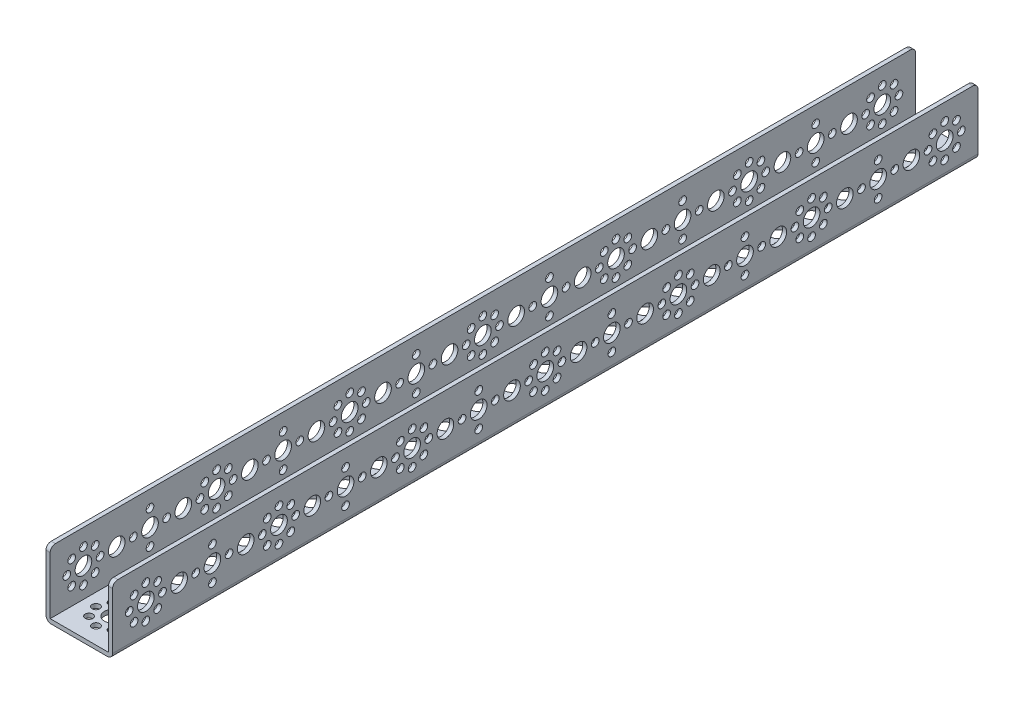
from build123d import *

# Parameters (mm, degrees)
SKETCH1_W                      = 32
SKETCH1_H                      = 416
BOSS_EXTRUDE1_DEPTH            = 32
SKETCH2_W                      = 28
SKETCH2_H                      = 30
CUT_EXTRUDE1_DEPTH             = 418.535627222
F_8_0_8_DIAMETER_HOLE1_D       = 8
F_8_0_8_DIAMETER_HOLE1_DEPTH   = 2
F_8_0_8_DIAMETER_HOLE2_D       = 8
F_8_0_8_DIAMETER_HOLE2_DEPTH   = 2
F_3_7_3_7_DIAMETER_HOLE1_D     = 3.7
F_3_7_3_7_DIAMETER_HOLE1_DEPTH = 2
F_3_7_3_7_DIAMETER_HOLE2_D     = 3.7
F_3_7_3_7_DIAMETER_HOLE2_DEPTH = 32
F_8_0_8_DIAMETER_HOLE3_D       = 8
F_8_0_8_DIAMETER_HOLE3_DEPTH   = 32
F_8_0_8_DIAMETER_HOLE4_D       = 8
F_8_0_8_DIAMETER_HOLE4_DEPTH   = 32
F_3_7_3_7_DIAMETER_HOLE3_D     = 3.7
F_3_7_3_7_DIAMETER_HOLE3_DEPTH = 32
FILLET1_R                      = 2.5


with BuildPart() as part:
    # Sketch1 → Boss-Extrude1 (new body)
    with BuildSketch(Plane(origin=(-16, 0, 0), x_dir=(0, -1, 0), z_dir=(-1, 0, 0))):
        with Locations((-16, -192)):
            Rectangle(SKETCH1_W, SKETCH1_H)
    extrude(amount=-BOSS_EXTRUDE1_DEPTH)

    # Sketch2 → Cut-Extrude1 (cut, through all)
    with BuildSketch(Plane.XY.offset(16)):
        with Locations((0, 17)):
            Rectangle(SKETCH2_W, SKETCH2_H)
    extrude(amount=-CUT_EXTRUDE1_DEPTH, mode=Mode.SUBTRACT)

    # Ø8.0 (8) Diameter Hole1
    with Locations(Plane.ZY.offset(-14)):
        with Locations((-32, 16)):
            Hole(F_8_0_8_DIAMETER_HOLE1_D / 2, depth=F_8_0_8_DIAMETER_HOLE1_DEPTH)

    # Ø8.0 (8) Diameter Hole2
    with Locations(Plane(origin=(16, 0, 0), x_dir=(0, 0, -1), z_dir=(1, 0, 0))):
        with Locations((64, 16), (128, 16), (192, 16), (256, 16), (320, 16), (384, 16), (96, 16), (160, 16), (224, 16), (288, 16), (352, 16), (16, 16), (48, 16), (80, 16), (112, 16), (144, 16), (176, 16), (208, 16), (240, 16), (0, 16), (272, 16), (304, 16), (336, 16), (368, 16)):
            Hole(F_8_0_8_DIAMETER_HOLE2_D / 2, depth=F_8_0_8_DIAMETER_HOLE2_DEPTH)

    # Ø3.7 (3.7) Diameter Hole1
    with Locations(Plane(origin=(16, 0, 0), x_dir=(0, 0, -1), z_dir=(1, 0, 0))):
        with Locations((0, 24), (0, 8), (8, 16), (-8, 16), (5.656854249, 21.656854249), (-5.656854249, 21.656854249), (-5.656854249, 10.343145751), (5.656854249, 10.343145751), (64, 24), (64, 8), (72, 16), (56, 16), (69.656854249, 21.656854249), (58.343145751, 21.656854249), (58.343145751, 10.343145751), (69.656854249, 10.343145751), (128, 24), (128, 8), (136, 16), (120, 16), (133.656854249, 21.656854249), (122.34314575, 21.656854249), (122.34314575, 10.343145751), (133.656854249, 10.343145751), (192, 24), (192, 8), (200, 16), (184, 16), (197.656854249, 21.656854249), (186.343145751, 21.656854249), (186.343145751, 10.343145751), (197.656854249, 10.343145751), (256, 24), (256, 8), (264, 16), (248, 16), (261.656854249, 21.656854249), (250.343145751, 21.656854249), (250.343145751, 10.343145751), (261.656854249, 10.343145751), (320, 24), (320, 8), (328, 16), (312, 16), (325.656854249, 21.656854249), (314.343145751, 21.656854249), (314.343145751, 10.343145751), (325.656854249, 10.343145751), (384, 24), (384, 8), (392, 16), (376, 16), (389.656854249, 21.656854249), (378.343145751, 21.656854249), (378.343145751, 10.343145751), (389.656854249, 10.343145751), (32, 24), (40, 16), (32, 8), (24, 16), (96, 24), (104, 16), (96, 8), (88, 16), (160, 24), (168, 16), (160, 8), (152, 16), (224, 24), (232, 16), (224, 8), (216, 16), (288, 24), (296, 16), (288, 8), (280, 16), (352, 24), (360, 16), (352, 8), (344, 16)):
            Hole(F_3_7_3_7_DIAMETER_HOLE1_D / 2, depth=F_3_7_3_7_DIAMETER_HOLE1_DEPTH)

    # Ø3.7 (3.7) Diameter Hole2
    with Locations(Plane(origin=(0, 0, 0), x_dir=(-1, 0, 0), z_dir=(0, -1, 0))):
        with Locations((8, 0), (5.656854249, 5.656854249), (0, 8), (-5.656854249, 5.656854249), (-8, 0), (-5.656854249, -5.656854249), (0, -8), (5.656854249, -5.656854249), (8, 64), (5.656854249, 69.656854249), (0, 72), (-5.656854249, 69.656854249), (-8, 64), (-5.656854249, 58.343145751), (0, 56), (5.656854249, 58.343145751), (8, 128), (5.656854249, 133.656854249), (0, 136), (-5.656854249, 133.656854249), (-8, 128), (-5.656854249, 122.34314575), (0, 120), (5.656854249, 122.34314575), (8, 192), (5.656854249, 197.656854249), (0, 200), (-5.656854249, 197.656854249), (-8, 192), (-5.656854249, 186.343145751), (0, 184), (5.656854249, 186.343145751), (8, 256), (5.656854249, 261.656854249), (0, 264), (-5.656854249, 261.656854249), (-8, 256), (-5.656854249, 250.343145751), (0, 248), (5.656854249, 250.343145751), (8, 320), (5.656854249, 325.656854249), (0, 328), (-5.656854249, 325.656854249), (-8, 320), (-5.656854249, 314.343145751), (0, 312), (5.656854249, 314.343145751), (8, 384), (5.656854249, 389.656854249), (0, 392), (-5.656854249, 389.656854249), (-8, 384), (-5.656854249, 378.343145751), (0, 376), (5.656854249, 378.343145751), (8, 32), (0, 40), (-8, 32), (0, 24), (8, 96), (0, 104), (-8, 96), (0, 88), (8, 160), (0, 168), (-8, 160), (0, 152), (8, 224), (0, 232), (-8, 224), (0, 216), (8, 288), (0, 296), (-8, 288), (0, 280), (8, 352), (0, 360), (-8, 352), (0, 344)):
            Hole(F_3_7_3_7_DIAMETER_HOLE2_D / 2, depth=F_3_7_3_7_DIAMETER_HOLE2_DEPTH)

    # Ø8.0 (8) Diameter Hole3
    with Locations(Plane(origin=(0, 0, 0), x_dir=(-1, 0, 0), z_dir=(0, -1, 0))):
        with Locations((0, 0), (0, 64), (0, 128), (0, 192), (0, 256), (0, 320), (0, 384), (0, 32), (0, 96), (0, 160), (0, 224), (0, 288), (0, 352), (0, 16), (0, 48), (0, 80), (0, 112), (0, 144), (0, 176), (0, 208), (0, 240), (0, 272), (0, 304), (0, 336), (0, 368)):
            Hole(F_8_0_8_DIAMETER_HOLE3_D / 2, depth=F_8_0_8_DIAMETER_HOLE3_DEPTH)

    # Ø8.0 (8) Diameter Hole4
    with Locations(Plane.ZY.offset(16)):
        with Locations((-64, 16), (-128, 16), (-192, 16), (-256, 16), (-320, 16), (-384, 16), (-32, 16), (-96, 16), (-160, 16), (-224, 16), (-288, 16), (-352, 16), (-16, 16), (-48, 16), (-80, 16), (-112, 16), (-144, 16), (-176, 16), (-208, 16), (-240, 16), (0, 16), (-272, 16), (-304, 16), (-336, 16), (-368, 16)):
            Hole(F_8_0_8_DIAMETER_HOLE4_D / 2, depth=F_8_0_8_DIAMETER_HOLE4_DEPTH)

    # Ø3.7 (3.7) Diameter Hole3
    with Locations(Plane.ZY.offset(16)):
        with Locations((0, 24), (0, 8), (-8, 16), (8, 16), (-5.656854249, 21.656854249), (5.656854249, 21.656854249), (5.656854249, 10.343145751), (-5.656854249, 10.343145751), (-64, 24), (-64, 8), (-72, 16), (-56, 16), (-69.656854249, 21.656854249), (-58.343145751, 21.656854249), (-58.343145751, 10.343145751), (-69.656854249, 10.343145751), (-128, 24), (-128, 8), (-136, 16), (-120, 16), (-133.656854249, 21.656854249), (-122.34314575, 21.656854249), (-122.34314575, 10.343145751), (-133.656854249, 10.343145751), (-192, 24), (-192, 8), (-200, 16), (-184, 16), (-197.656854249, 21.656854249), (-186.343145751, 21.656854249), (-186.343145751, 10.343145751), (-197.656854249, 10.343145751), (-256, 24), (-256, 8), (-264, 16), (-248, 16), (-261.656854249, 21.656854249), (-250.343145751, 21.656854249), (-250.343145751, 10.343145751), (-261.656854249, 10.343145751), (-320, 24), (-320, 8), (-328, 16), (-312, 16), (-325.656854249, 21.656854249), (-314.343145751, 21.656854249), (-314.343145751, 10.343145751), (-325.656854249, 10.343145751), (-384, 24), (-384, 8), (-392, 16), (-376, 16), (-389.656854249, 21.656854249), (-378.343145751, 21.656854249), (-378.343145751, 10.343145751), (-389.656854249, 10.343145751), (-32, 24), (-40, 16), (-32, 8), (-24, 16), (-96, 24), (-104, 16), (-96, 8), (-88, 16), (-160, 24), (-168, 16), (-160, 8), (-152, 16), (-224, 24), (-232, 16), (-224, 8), (-216, 16), (-288, 24), (-296, 16), (-288, 8), (-280, 16), (-352, 24), (-360, 16), (-352, 8), (-344, 16)):
            Hole(F_3_7_3_7_DIAMETER_HOLE3_D / 2, depth=F_3_7_3_7_DIAMETER_HOLE3_DEPTH)

    # Fillet1
    fillet1_edges = [part.edges().sort_by_distance(p)[0] for p in [
        (16, 0, -192),
        (-15, 32, -400),
        (-15, 32, 16),
        (-16, 0, -192),
        (15, 32, 16),
        (15, 32, -400),
    ]]
    fillet(fillet1_edges, radius=FILLET1_R)


solid = part.part
